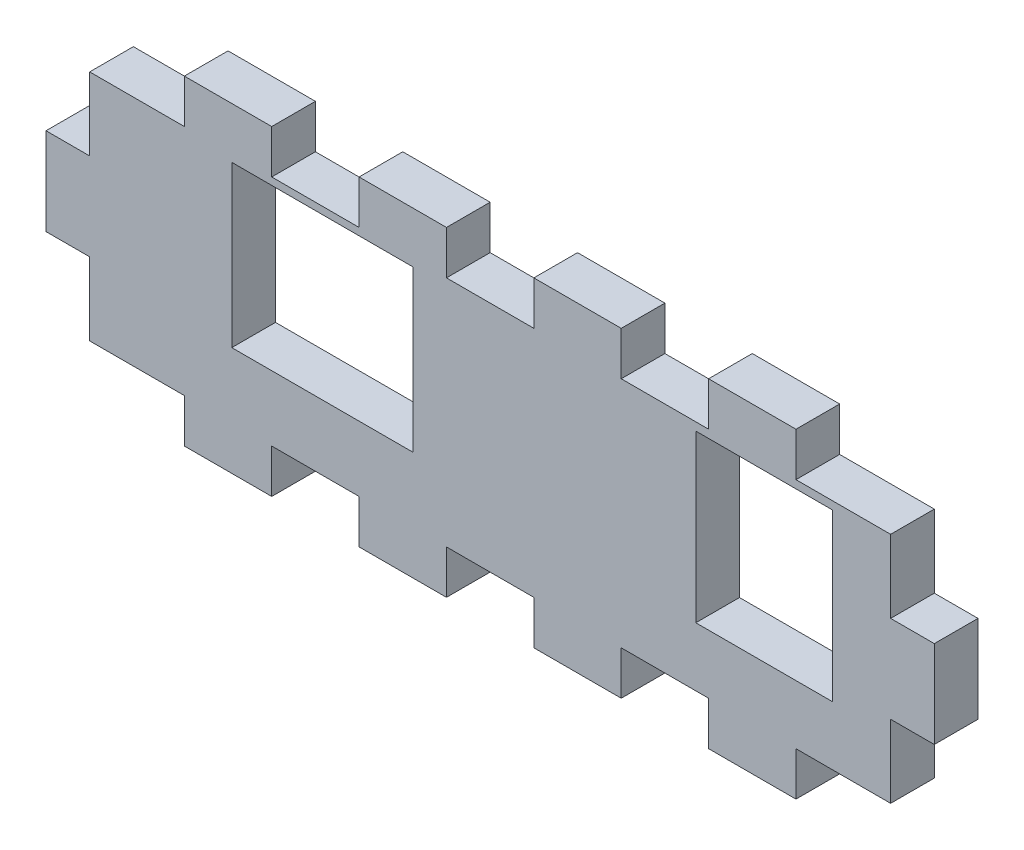
from build123d import *

# Parameters (mm, degrees)
EXTRUDE_1_DEPTH     = 3
CUT_EXTRUDE_1_DEPTH = 159.142340946


with BuildPart() as part:
    # Model → 凸台-拉伸1 (new body)
    with BuildSketch(Plane.XY):
        Polygon((92, 47), (92, 42), (89, 42), (89, 36), (92, 36), (92, 31), (98.5, 31), (98.5, 28), (104.5, 28), (104.5, 31), (110.5, 31), (110.5, 28), (116.5, 28), (116.5, 31), (122.5, 31), (122.5, 28), (128.5, 28), (128.5, 31), (134.5, 31), (134.5, 28), (140.5, 28), (140.5, 31), (146.5, 31), (147, 31), (147, 36), (150, 36), (150, 42), (147, 42), (147, 47), (140.5, 47), (140.5, 50), (134.5, 50), (134.5, 47), (128.5, 47), (128.5, 50), (122.5, 50), (122.5, 47), (116.5, 47), (116.5, 50), (110.5, 50), (110.5, 47), (104.5, 47), (104.5, 50), (98.5, 50), (98.5, 47), (92.5, 47), align=None)
    extrude(amount=EXTRUDE_1_DEPTH)

    # 草图2 → 切除-拉伸1 (cut, through all)
    with BuildSketch(Plane.XY.offset(3)):
        Polygon((133.622004458, 45.75), (133.622004458, 46.45), (134.322004458, 46.45), (142.322004458, 46.45), (143.022004458, 46.45), (143.022004458, 45.75), (143.022004458, 35.05), (133.622004458, 35.05), align=None)
        Polygon((114.197004458, 35.48), (101.757004458, 35.48), (101.757004458, 45.74), (101.757004458, 46.5), (114.197004458, 46.5), (114.197004458, 45.74), align=None)
    extrude(amount=-CUT_EXTRUDE_1_DEPTH, mode=Mode.SUBTRACT)


solid = part.part
